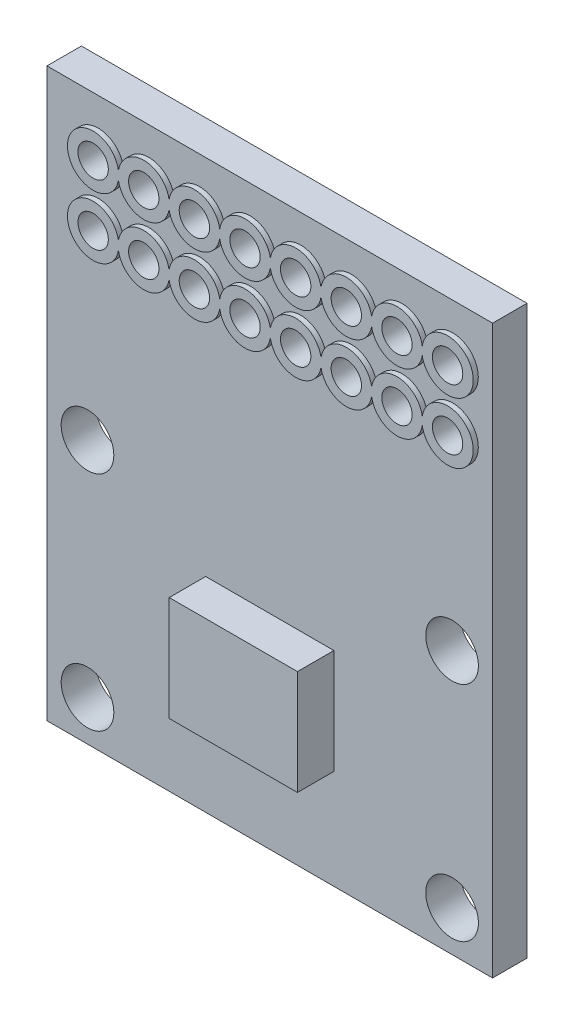
from build123d import *

# Parameters (mm, degrees)
ESQUISSE1_W                     = 22
ESQUISSE1_H                     = 28
ESQUISSE1_R                     = 1.3
BOSS_EXTRU_1_DEPTH              = 1.7
ESQUISSE2_W                     = 6.33
ESQUISSE2_H                     = 5.17
BOSS_EXTRU_2_DEPTH              = 1.8
ESQUISSE3_R                     = 0.75
ENL_V_MAT_EXTRU_1_DEPTH         = 18.895250767
R_P_TITION_LIN_AIRE1_COUNT      = 8
R_P_TITION_LIN_AIRE1_PITCH      = 2.5
R_P_TITION_LIN_AIRE1_COUNT_DIR2 = 2
R_P_TITION_LIN_AIRE1_PITCH_DIR2 = 3
BOSS_EXTRU_3_START              = 0.25
ESQUISSE4_R                     = 1.267027295
ESQUISSE4_R_2                   = 0.75
BOSS_EXTRU_3_DEPTH              = 2.15
R_P_TITION_LIN_AIRE2_COUNT      = 8
R_P_TITION_LIN_AIRE2_PITCH      = 2.5
R_P_TITION_LIN_AIRE2_COUNT_DIR2 = 2
R_P_TITION_LIN_AIRE2_PITCH_DIR2 = 3


with BuildPart() as part:
    # Esquisse1 → Boss.-Extru.1 (new body)
    with BuildSketch(Plane.XY):
        Rectangle(ESQUISSE1_W, ESQUISSE1_H)
        with Locations((-9, -1)):
            Circle(ESQUISSE1_R, mode=Mode.SUBTRACT)
        with Locations((9, -1)):
            Circle(ESQUISSE1_R, mode=Mode.SUBTRACT)
        with Locations((9, -12)):
            Circle(ESQUISSE1_R, mode=Mode.SUBTRACT)
        with Locations((-9, -12)):
            Circle(ESQUISSE1_R, mode=Mode.SUBTRACT)
    extrude(amount=BOSS_EXTRU_1_DEPTH)

    # Esquisse2 → Boss.-Extru.2 (add)
    with BuildSketch(Plane.XY.offset(1.7)):
        with Locations((0, -6.5)):
            Rectangle(ESQUISSE2_W, ESQUISSE2_H)
    extrude(amount=BOSS_EXTRU_2_DEPTH)

    # Esquisse3 → Enlèv. mat.-Extru.1 (cut, through all)
    with BuildSketch(Plane.XY.offset(1.7)):
        with Locations((-8.47184488, 11.336604358)):
            Circle(ESQUISSE3_R)
    enl_v_mat_extru_1 = extrude(amount=-ENL_V_MAT_EXTRU_1_DEPTH, mode=Mode.SUBTRACT)

    # Répétition linéaire1: Enl_v. mat.-Extru.1 8 × 2
    with Locations(*[(i * R_P_TITION_LIN_AIRE1_PITCH, -j * R_P_TITION_LIN_AIRE1_PITCH_DIR2, 0) for i in range(R_P_TITION_LIN_AIRE1_COUNT) for j in range(R_P_TITION_LIN_AIRE1_COUNT_DIR2) if (i, j) != (0, 0)]):
        add(enl_v_mat_extru_1, mode=Mode.SUBTRACT)

    # Esquisse4 → Boss.-Extru.3 (add)
    with BuildSketch(Plane.XY.offset(1.7).offset(BOSS_EXTRU_3_START)):
        with Locations((-8.47184488, 11.336604358)):
            Circle(ESQUISSE4_R)
        with Locations((-8.47184488, 11.336604358)):
            Circle(ESQUISSE4_R_2, mode=Mode.SUBTRACT)
    boss_extru_3 = extrude(amount=-BOSS_EXTRU_3_DEPTH)

    # Répétition linéaire2: Boss.-Extru.3 8 × 2
    with Locations(*[(i * R_P_TITION_LIN_AIRE2_PITCH, -j * R_P_TITION_LIN_AIRE2_PITCH_DIR2, 0) for i in range(R_P_TITION_LIN_AIRE2_COUNT) for j in range(R_P_TITION_LIN_AIRE2_COUNT_DIR2) if (i, j) != (0, 0)]):
        add(boss_extru_3)


solid = part.part
